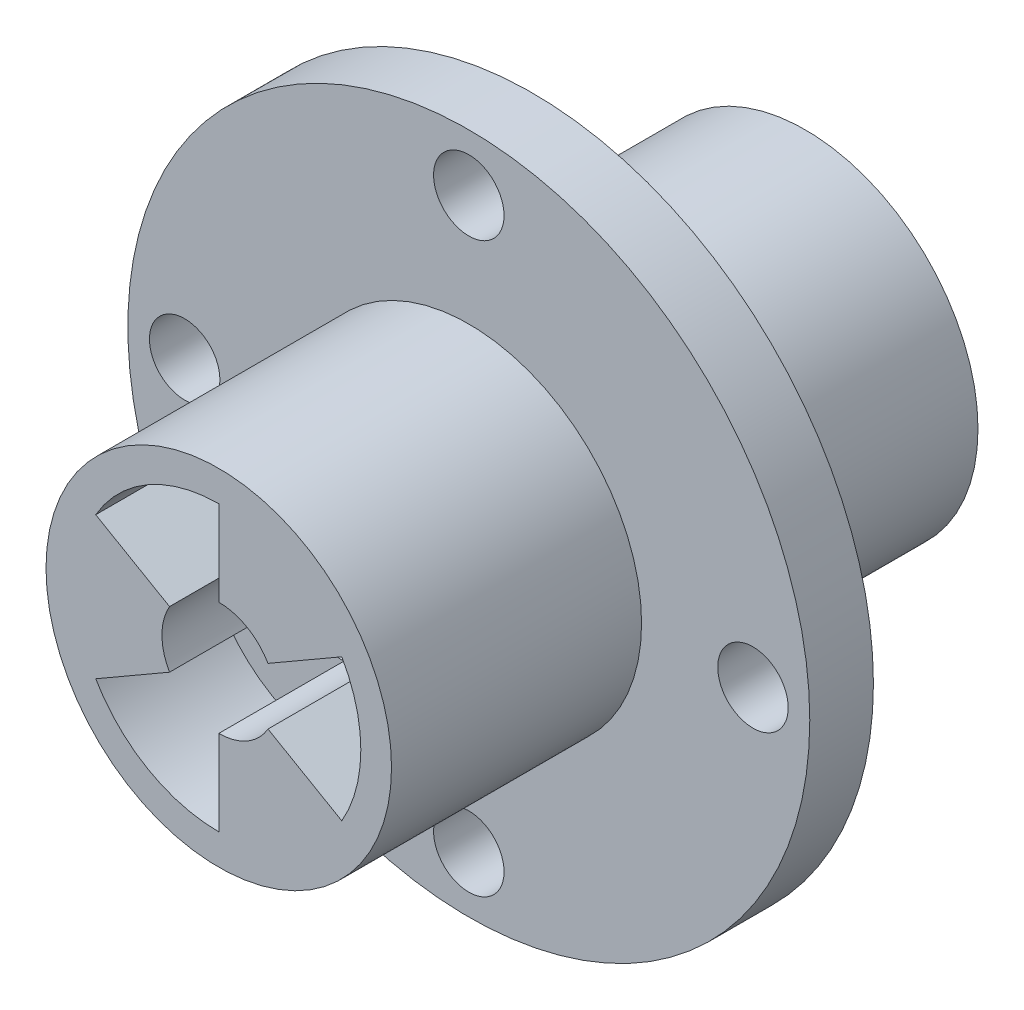
from build123d import *

# Parameters (mm, degrees)
SKETCH1_R               = 15
SKETCH1_R_2             = 1.55
BOSS_EXTRUDE1_DEPTH     = 2.8
BOSS_EXTRUDE2_START     = 2.8
SKETCH3_R               = 7.6
BOSS_EXTRUDE2_DEPTH     = 11
CUT_EXTRUDE1_DEPTH      = 26.306916051
CUT_EXTRUDE1_DEPTH_BACK = 26.306916051
SKETCH4_R               = 2.5
SKETCH5_R               = 5
CUT_EXTRUDE2_DEPTH      = 5.5
BOSS_EXTRUDE3_START     = 12
SKETCH7_R               = 7.6
SKETCH7_R_2             = 3.2
BOSS_EXTRUDE3_DEPTH     = 12
SKETCH8_R               = 3.2
SKETCH8_R_2             = 2.5
BOSS_EXTRUDE4_DEPTH     = 8
BOSS_EXTRUDE5_START     = 3
SKETCH9_R               = 8.25
SKETCH9_R_2             = 7.6
BOSS_EXTRUDE5_DEPTH     = 3
FILLET2_R               = 1
BOSS_EXTRUDE6_START     = 5.5
SKETCH11_R              = 5
SKETCH11_R_2            = 2.5
BOSS_EXTRUDE6_DEPTH     = 5.5
CUT_EXTRUDE3_DEPTH      = 5.5
BOSS_EXTRUDE7_START     = -18.3
SKETCH12_R              = 2.5
BOSS_EXTRUDE7_DEPTH     = 13.3


with BuildPart() as part:
    # Sketch1 → Boss-Extrude1 (new body)
    with BuildSketch(Plane.XY):
        Circle(SKETCH1_R)
        with Locations((0, 12.5)):
            Circle(SKETCH1_R_2, mode=Mode.SUBTRACT)
        with Locations((12.5, 0)):
            Circle(SKETCH1_R_2, mode=Mode.SUBTRACT)
        with Locations((0, -12.5)):
            Circle(SKETCH1_R_2, mode=Mode.SUBTRACT)
        with Locations((-12.5, 0)):
            Circle(SKETCH1_R_2, mode=Mode.SUBTRACT)
    extrude(amount=BOSS_EXTRUDE1_DEPTH)

    # Sketch3 → Boss-Extrude2 (add)
    with BuildSketch(Plane.XY.offset(BOSS_EXTRUDE2_START)):
        Circle(SKETCH3_R)
    extrude(amount=BOSS_EXTRUDE2_DEPTH)

    # Sketch4 → Cut-Extrude1 (cut, two sides: drawn at the far end of the back side and taken through both)
    with BuildSketch(Plane.XY.offset(13.8).offset(-CUT_EXTRUDE1_DEPTH_BACK)):
        Circle(SKETCH4_R)
    extrude(amount=CUT_EXTRUDE1_DEPTH + CUT_EXTRUDE1_DEPTH_BACK, mode=Mode.SUBTRACT)

    # Sketch5 → Cut-Extrude2 (cut)
    with BuildSketch(Plane.XY.offset(13.8)):
        Circle(SKETCH5_R)
    extrude(amount=-CUT_EXTRUDE2_DEPTH, mode=Mode.SUBTRACT)

    # Sketch7 → Boss-Extrude3 (add)
    with BuildSketch(Plane(origin=(0, 0, 0), x_dir=(-1, 0, 0), z_dir=(0, 0, -1)).offset(BOSS_EXTRUDE3_START)):
        with Locations(Location((0, 0, 0), (0, 0, 180))):
            Circle(SKETCH7_R)
        Circle(SKETCH7_R_2, mode=Mode.SUBTRACT)
    extrude(amount=-BOSS_EXTRUDE3_DEPTH)

    # Sketch8 → Boss-Extrude4 (add)
    with BuildSketch(Plane(origin=(0, 0, 0), x_dir=(-1, 0, 0), z_dir=(0, 0, -1))):
        Circle(SKETCH8_R)
        with Locations(Location((0, 0, 0), (0, 0, 180))):
            Circle(SKETCH8_R_2, mode=Mode.SUBTRACT)
    extrude(amount=BOSS_EXTRUDE4_DEPTH)

    # Sketch9 → Boss-Extrude5 (add)
    with BuildSketch(Plane(origin=(0, 0, 0), x_dir=(-1, 0, 0), z_dir=(0, 0, -1)).offset(BOSS_EXTRUDE5_START)):
        with Locations(Location((0, 0, 0), (0, 0, 180))):
            Circle(SKETCH9_R)
        with Locations(Location((0, 0, 0), (0, 0, 180))):
            Circle(SKETCH9_R_2, mode=Mode.SUBTRACT)
    extrude(amount=-BOSS_EXTRUDE5_DEPTH)

    # Fillet2
    fillet2_edges = [part.edges().sort_by_distance(p)[0] for p in [
        (-8.25, 0, 0),
    ]]
    fillet(fillet2_edges, radius=FILLET2_R)

    # Sketch11 → Boss-Extrude6 (add)
    with BuildSketch(Plane.XY.offset(8.3).offset(BOSS_EXTRUDE6_START)):
        Circle(SKETCH11_R)
        Circle(SKETCH11_R_2, mode=Mode.SUBTRACT)
    extrude(amount=-BOSS_EXTRUDE6_DEPTH)

    # Sketch10 → Cut-Extrude3 (cut)
    with BuildSketch(Plane.XY.offset(13.8)):
        with BuildLine():
            Line((0, 0), (5.412658774, -3.125))
            ThreePointArc((5.412658774, -3.125), (6.25, 0), (5.412658774, 3.125))
            Line((5.412658774, 3.125), (0, 0))
        make_face()
        with BuildLine():
            Line((-5.412658774, 3.125), (0, 0))
            Line((0, 0), (0, 6.25))
            ThreePointArc((0, 6.25), (-3.125, 5.412658774), (-5.412658774, 3.125))
        make_face()
        with BuildLine():
            Line((0, -6.25), (0, 0))
            Line((0, 0), (-5.412658774, -3.125))
            ThreePointArc((-5.412658774, -3.125), (-3.125, -5.412658774), (0, -6.25))
        make_face()
    extrude(amount=-CUT_EXTRUDE3_DEPTH, mode=Mode.SUBTRACT)

    # Sketch12 → Boss-Extrude7 (add)
    with BuildSketch(Plane(origin=(0, 0, -12), x_dir=(-1, 0, 0), z_dir=(0, 0, -1)).offset(BOSS_EXTRUDE7_START)):
        with Locations(Location((0, 0, 0), (0, 0, 180))):
            Circle(SKETCH12_R)
    extrude(amount=BOSS_EXTRUDE7_DEPTH)


solid = part.part
